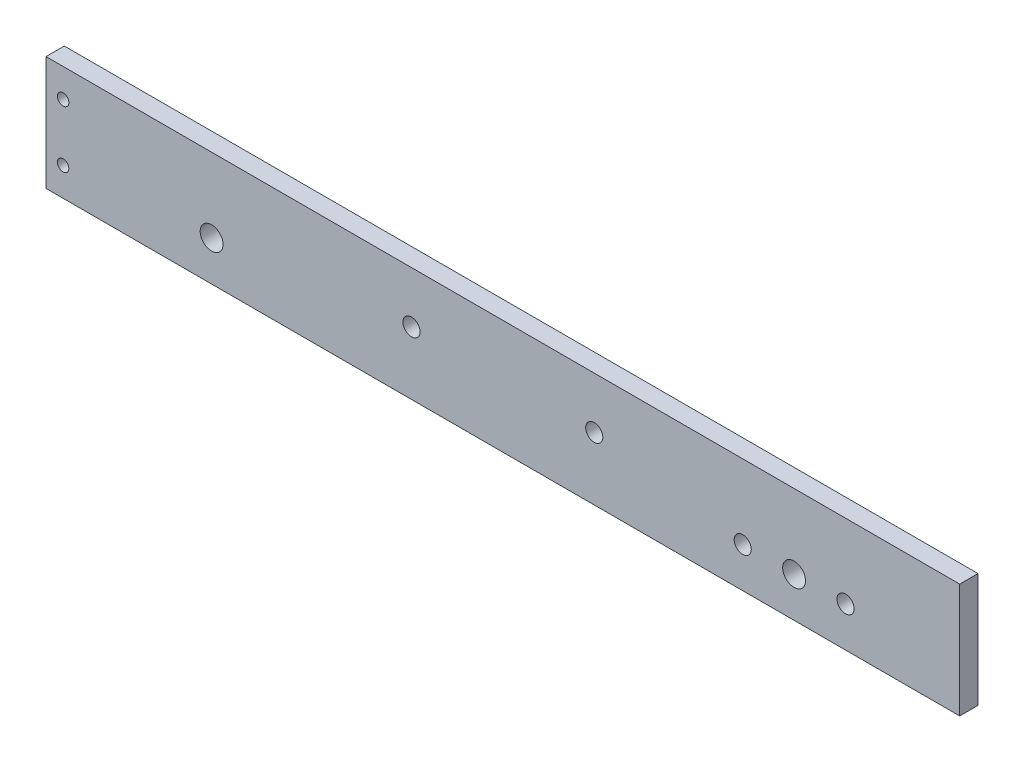
from build123d import *

# Parameters (mm, degrees)
SKETCH2_W               = 160
SKETCH2_H               = 20
BOSS_EXTRUDE1_DEPTH     = 3.2
CUT_EXTRUDE1_DEPTH      = 162.276904732
CUT_EXTRUDE1_DEPTH_BACK = 162.276904732
SKETCH5_R               = 2
SKETCH6_R               = 1.5
CUT_EXTRUDE2_DEPTH      = 10
CUT_EXTRUDE3_DEPTH      = 162.276904732
CUT_EXTRUDE3_DEPTH_BACK = 162.276904732
SKETCH7_R               = 1
SKETCH8_R               = 1.5
CUT_EXTRUDE4_DEPTH      = 10


with BuildPart() as part:
    # Sketch2 → Boss-Extrude1 (new body)
    with BuildSketch(Plane(origin=(0, -10, 10), x_dir=(1, 0, 0), z_dir=(0, 0, -1))):
        with Locations((80, 0)):
            Rectangle(SKETCH2_W, SKETCH2_H)
    extrude(amount=BOSS_EXTRUDE1_DEPTH)

    # Sketch5 → Cut-Extrude1 (cut, two sides: drawn at the far end of the back side and taken through both)
    with BuildSketch(Plane.XY.offset(10).offset(-CUT_EXTRUDE1_DEPTH_BACK)):
        with Locations((131, -13)):
            Circle(SKETCH5_R)
        with Locations((29, -13)):
            Circle(SKETCH5_R)
    extrude(amount=CUT_EXTRUDE1_DEPTH + CUT_EXTRUDE1_DEPTH_BACK, mode=Mode.SUBTRACT)

    # Sketch6 → Cut-Extrude2 (cut)
    with BuildSketch(Plane.XY.offset(10)):
        with Locations((64, -9)):
            Circle(SKETCH6_R)
        with Locations((96, -9)):
            Circle(SKETCH6_R)
    extrude(amount=-CUT_EXTRUDE2_DEPTH, mode=Mode.SUBTRACT)

    # Sketch7 → Cut-Extrude3 (cut, two sides: drawn at the far end of the back side and taken through both)
    with BuildSketch(Plane.XY.offset(10).offset(-CUT_EXTRUDE3_DEPTH_BACK)):
        with Locations((3, -15)):
            Circle(SKETCH7_R)
        with Locations((3, -5)):
            Circle(SKETCH7_R)
    extrude(amount=CUT_EXTRUDE3_DEPTH + CUT_EXTRUDE3_DEPTH_BACK, mode=Mode.SUBTRACT)

    # Sketch8 → Cut-Extrude4 (cut)
    with BuildSketch(Plane.XY.offset(10)):
        with Locations((140, -13)):
            Circle(SKETCH8_R)
        with Locations((122, -13)):
            Circle(SKETCH8_R)
    extrude(amount=-CUT_EXTRUDE4_DEPTH, mode=Mode.SUBTRACT)


solid = part.part
